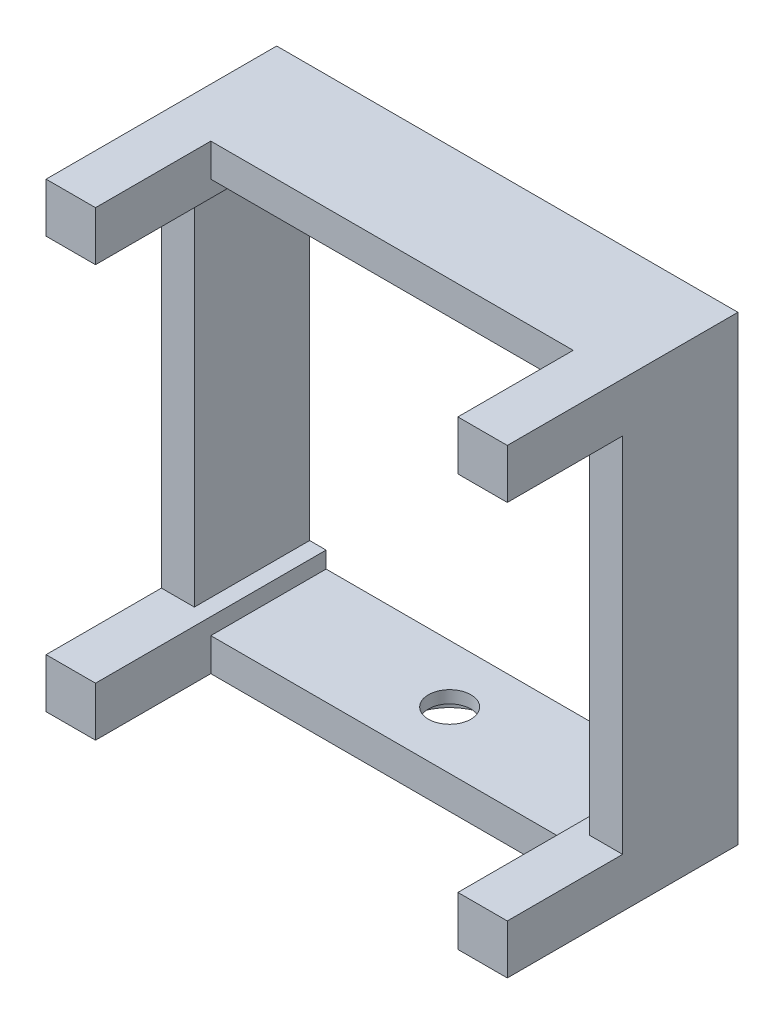
from build123d import *

# Parameters (mm, degrees)
CROQUIS1_W                   = 112
CROQUIS1_H                   = 112
CROQUIS1_W_2                 = 96
CROQUIS1_H_2                 = 96
SALIENTE_EXTRUIR2_DEPTH      = 28
CROQUIS2_R                   = 5.155
CORTAR_EXTRUIR1_DEPTH        = 8
CROQUIS3_R                   = 11.115
CORTAR_EXTRUIR2_DEPTH        = 5
CROQUIS4_R                   = 6.5
CORTAR_EXTRUIR3_DEPTH        = 5
SALIENTE_EXTRUIR3_DEPTH      = 28
SALIENTE_EXTRUIR3_DEPTH_BACK = 28
CROQUIS5_W                   = 12
CROQUIS5_H                   = 12


with BuildPart() as part:
    # Croquis1 → Saliente-Extruir2 (new body)
    with BuildSketch(Plane.XY):
        with Locations((32.5, 32.5)):
            Rectangle(CROQUIS1_W, CROQUIS1_H)
        with Locations((32.5, 32.5)):
            Rectangle(CROQUIS1_W_2, CROQUIS1_H_2, mode=Mode.SUBTRACT)
    extrude(amount=-SALIENTE_EXTRUIR2_DEPTH)

    # Croquis2 → Cortar-Extruir1 (cut)
    with BuildSketch(Plane.XZ.offset(23.5)):
        with Locations((32.5, -14)):
            Circle(CROQUIS2_R)
    extrude(amount=-CORTAR_EXTRUIR1_DEPTH, mode=Mode.SUBTRACT)

    # Croquis3 → Cortar-Extruir2 (cut)
    with BuildSketch(Plane.XZ.offset(23.5)):
        with Locations((32.5, -14)):
            Circle(CROQUIS3_R)
    extrude(amount=-CORTAR_EXTRUIR2_DEPTH, mode=Mode.SUBTRACT)

    # Croquis4 → Cortar-Extruir3 (cut)
    with BuildSketch(Plane.XZ.offset(-80.5)):
        with Locations((32.5, -14)):
            Circle(CROQUIS4_R)
    extrude(amount=-CORTAR_EXTRUIR3_DEPTH, mode=Mode.SUBTRACT)

    # Croquis5 → Saliente-Extruir3 (add, two sides: drawn at the far end of the back side and taken through both)
    with BuildSketch(Plane.XY.offset(-SALIENTE_EXTRUIR3_DEPTH_BACK)):
        with Locations((-17.5, 82.5)):
            Rectangle(CROQUIS5_W, CROQUIS5_H)
        with Locations((-17.5, -17.5)):
            Rectangle(CROQUIS5_W, CROQUIS5_H)
        with Locations((82.5, -17.5)):
            Rectangle(CROQUIS5_W, CROQUIS5_H)
        with Locations((82.5, 82.5)):
            Rectangle(CROQUIS5_W, CROQUIS5_H)
    extrude(amount=SALIENTE_EXTRUIR3_DEPTH + SALIENTE_EXTRUIR3_DEPTH_BACK)


solid = part.part
